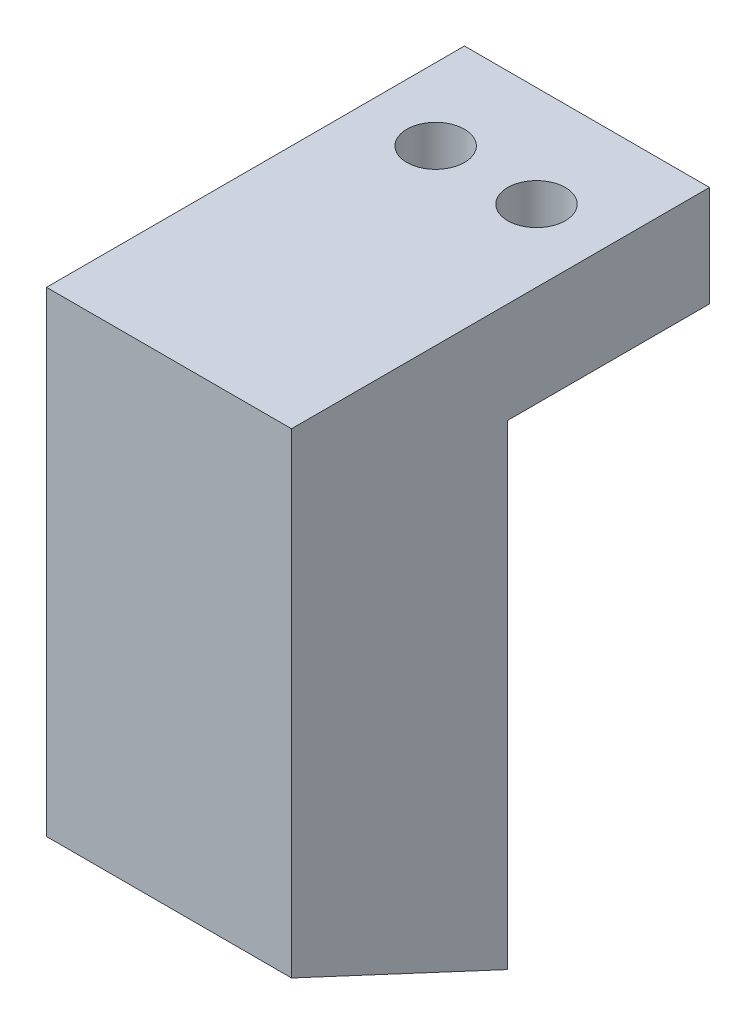
from build123d import *

# Parameters (mm, degrees)
SKETCH1_W           = 17
SKETCH1_H           = 15
BOSS_EXTRUDE1_DEPTH = 40
CUT_EXTRUDE1_DEPTH  = 40
SKETCH3_R           = 1.5
CUT_EXTRUDE2_DEPTH  = 36
SKETCH4_W           = 17
SKETCH4_H           = 7
BOSS_EXTRUDE2_DEPTH = 14
SKETCH5_R           = 2
CUT_EXTRUDE3_DEPTH  = 14


with BuildPart() as part:
    # Sketch1 → Boss-Extrude1 (new body)
    with BuildSketch(Plane(origin=(0, 0, 0), x_dir=(1, 0, 0), z_dir=(0, 1, 0))):
        with Locations((-68.404761905, 8.571428571)):
            Rectangle(SKETCH1_W, SKETCH1_H)
    extrude(amount=BOSS_EXTRUDE1_DEPTH)

    # Sketch2 → Cut-Extrude1 (cut)
    with BuildSketch(Plane(origin=(-59.904761905, 0, 0), x_dir=(0, 0, -1), z_dir=(1, 0, 0))):
        Polygon((16.071428571, 0), (1.071428571, 0), (1.071428571, 6.994614872), align=None)
    extrude(amount=-CUT_EXTRUDE1_DEPTH, mode=Mode.SUBTRACT)

    # Sketch3 → Cut-Extrude2 (cut)
    with BuildSketch(Plane(origin=(0, 6.155714275, -2.870456708), x_dir=(1, 0, 0), z_dir=(0, -0.9063077870366528, 0.4226182617406934))):
        with Locations(Location((-68.369326665, -5.514992079, 0), (0, 0, 270))):
            Circle(SKETCH3_R)
    extrude(amount=-CUT_EXTRUDE2_DEPTH, mode=Mode.SUBTRACT)

    # Sketch4 → Boss-Extrude2 (add)
    with BuildSketch(Plane(origin=(0, 0, -16.071428571), x_dir=(-1, 0, 0), z_dir=(0, 0, -1))):
        with Locations((68.404761905, 36.5)):
            Rectangle(SKETCH4_W, SKETCH4_H)
    extrude(amount=BOSS_EXTRUDE2_DEPTH)

    # Sketch5 → Cut-Extrude3 (cut)
    with BuildSketch(Plane(origin=(0, 33, 0), x_dir=(-1, 0, 0), z_dir=(0, -1, 0))):
        with Locations(Location((71.904761905, 23.071428571, 0), (0, 0, 90))):
            Circle(SKETCH5_R)
        with Locations(Location((64.904761905, 23.071428571, 0), (0, 0, 90))):
            Circle(SKETCH5_R)
    extrude(amount=-CUT_EXTRUDE3_DEPTH, mode=Mode.SUBTRACT)


solid = part.part
